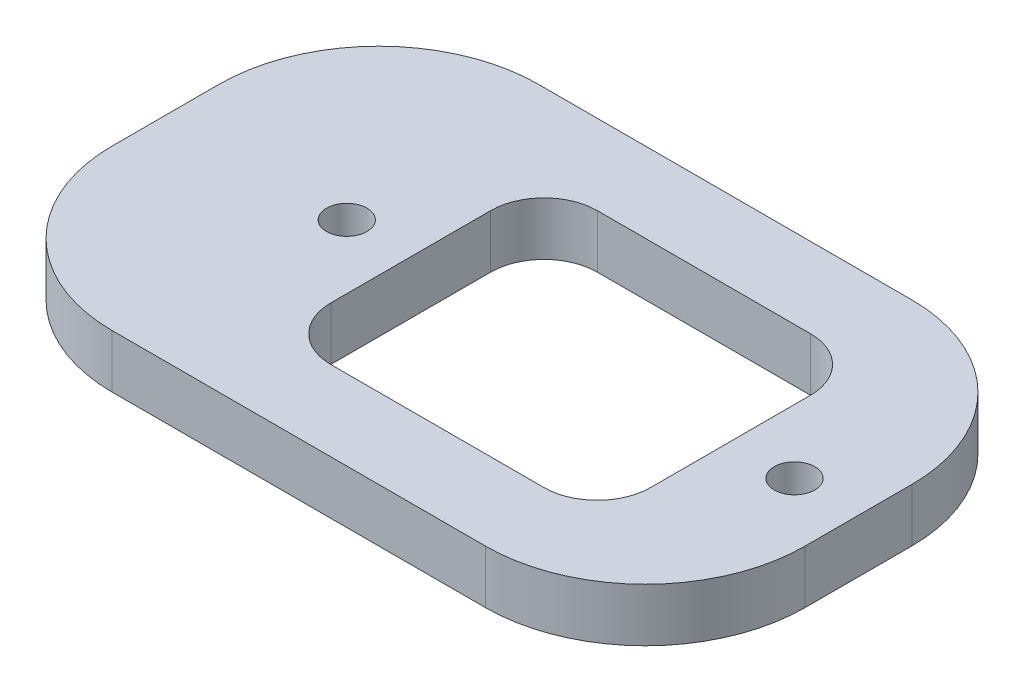
from build123d import *

# Parameters (mm, degrees)
BOSS_EXTRUDE1_DEPTH                             = 6.35
CSK_FOR_10_FLAT_HEAD_MACHINE_SCREW1_D           = 4.826
CSK_FOR_10_FLAT_HEAD_MACHINE_SCREW1_CSINK_D     = 9.525
CSK_FOR_10_FLAT_HEAD_MACHINE_SCREW1_CSINK_ANGLE = 82


with BuildPart() as part:
    # Sketch1 → Boss-Extrude1 (new body)
    with BuildSketch(Plane(origin=(0, 0, 0), x_dir=(1, 0, 0), z_dir=(0, 1, 0))):
        with BuildLine():
            Line((13.97, 6.35), (-30.48, 6.35))
            ThreePointArc((-30.48, 6.35), (-43.950384182, 0.770384182), (-49.53, -12.7))
            Line((-49.53, -12.7), (-49.53, -25.4))
            ThreePointArc((-49.53, -25.4), (-43.950384182, -38.870384182), (-30.48, -44.45))
            Line((-30.48, -44.45), (13.97, -44.45))
            ThreePointArc((13.97, -44.45), (27.440384182, -38.870384182), (33.02, -25.4))
            Line((33.02, -25.4), (33.02, -12.7))
            ThreePointArc((33.02, -12.7), (27.440384182, 0.770384182), (13.97, 6.35))
        make_face()
        with BuildLine():
            Line((-20.32, -12.7), (-20.32, -25.4))
            Line((-20.32, -25.4), (-20.32, -28.575))
            ThreePointArc((-20.32, -28.575), (-18.460128061, -33.065128061), (-13.97, -34.925))
            Line((-13.97, -34.925), (11.43, -34.925))
            ThreePointArc((11.43, -34.925), (15.920128061, -33.065128061), (17.78, -28.575))
            Line((17.78, -28.575), (17.78, -25.4))
            Line((17.78, -25.4), (17.78, -12.7))
            Line((17.78, -12.7), (17.78, -9.525))
            ThreePointArc((17.78, -9.525), (15.920128061, -5.034871939), (11.43, -3.175))
            Line((11.43, -3.175), (-13.97, -3.175))
            ThreePointArc((-13.97, -3.175), (-18.460128061, -5.034871939), (-20.32, -9.525))
            Line((-20.32, -9.525), (-20.32, -12.7))
        make_face(mode=Mode.SUBTRACT)
    extrude(amount=BOSS_EXTRUDE1_DEPTH)

    # CSK for #10 Flat Head Machine Screw1 (through all)
    with Locations(Plane(origin=(0, 0, 0), x_dir=(-1, 0, 0), z_dir=(0, -1, 0))):
        with Locations((27.94, -19.05), (-25.4, -19.05)):
            CounterSinkHole(CSK_FOR_10_FLAT_HEAD_MACHINE_SCREW1_D / 2, CSK_FOR_10_FLAT_HEAD_MACHINE_SCREW1_CSINK_D / 2, counter_sink_angle=CSK_FOR_10_FLAT_HEAD_MACHINE_SCREW1_CSINK_ANGLE)


solid = part.part
